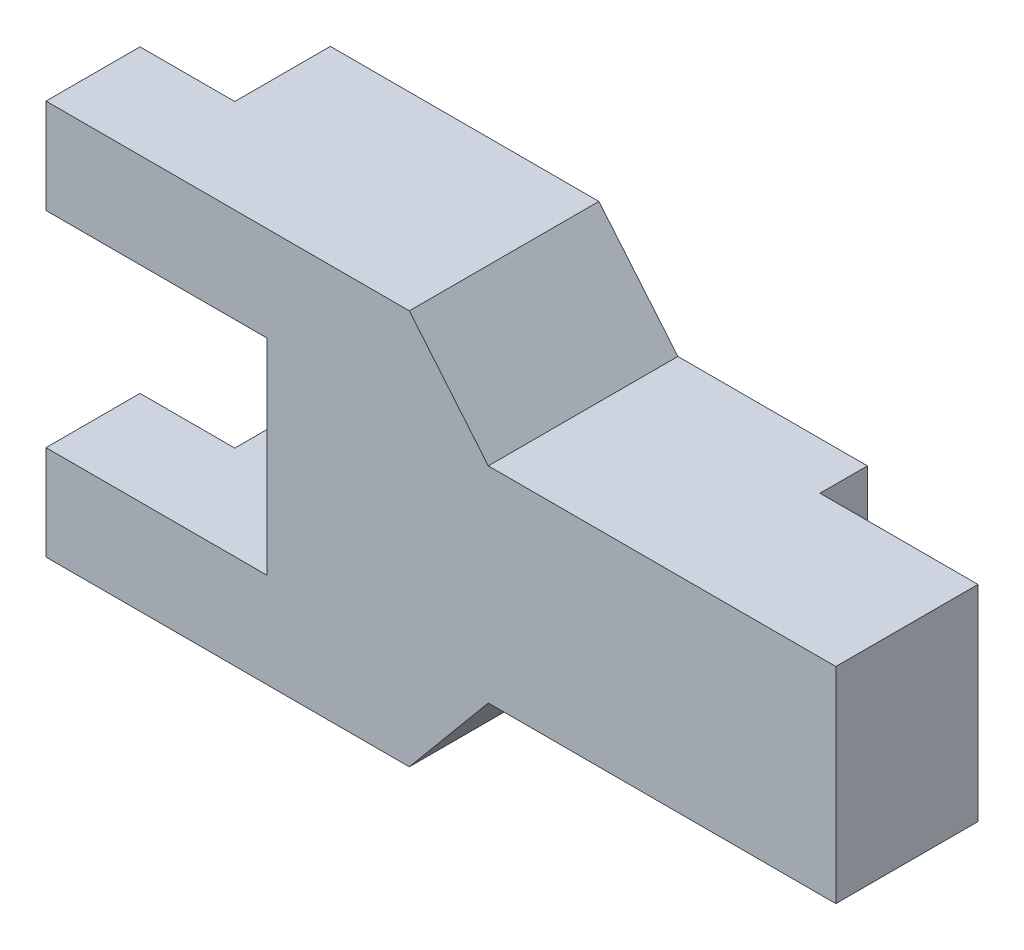
from build123d import *

# Parameters (mm, degrees)
Y_KSEKLIK_EKSTR_ZYON3_DEPTH = 609.6
IZIM2_W                     = 508
IZIM2_H                     = 660.4
KES_EKSTR_ZYON1_DEPTH       = 152.4
IZIM3_W                     = 304.8
IZIM3_H                     = 304.8
KES_EKSTR_ZYON2_DEPTH       = 307.34


with BuildPart() as part:
    # Çizim1 → Yükseklik-Ekstrüzyon3 (new body)
    with BuildSketch(Plane.XY):
        Polygon((-283.176149051, 779.0060667), (-1400.776149051, 779.0060667), (-1654.776149051, 1083.8060667), (-2823.176149051, 1083.8060667), (-2823.176149051, 779.0060667), (-2111.976149051, 779.0060667), (-2111.976149051, 118.6060667), (-2823.176149051, 118.6060667), (-2823.176149051, -186.1939333), (-1654.776149051, -186.1939333), (-1400.776149051, 118.6060667), (-283.176149051, 118.6060667), align=None)
    extrude(amount=Y_KSEKLIK_EKSTR_ZYON3_DEPTH)

    # Çizim2 → Kes-Ekstrüzyon1 (cut)
    with BuildSketch(Plane(origin=(0, 0, 0), x_dir=(-1, 0, 0), z_dir=(0, 0, -1))):
        with Locations((537.176149051, 448.8060667)):
            Rectangle(IZIM2_W, IZIM2_H)
    extrude(amount=-KES_EKSTR_ZYON1_DEPTH, mode=Mode.SUBTRACT)

    # Çizim3 → Kes-Ekstrüzyon2 (cut)
    with BuildSketch(Plane(origin=(0, 0, 0), x_dir=(-1, 0, 0), z_dir=(0, 0, -1))):
        with Locations((2670.776149051, -33.7939333)):
            Rectangle(IZIM3_W, IZIM3_H)
        with Locations((2670.776149051, 931.4060667)):
            Rectangle(IZIM3_W, IZIM3_H)
    extrude(amount=-KES_EKSTR_ZYON2_DEPTH, mode=Mode.SUBTRACT)


solid = part.part
